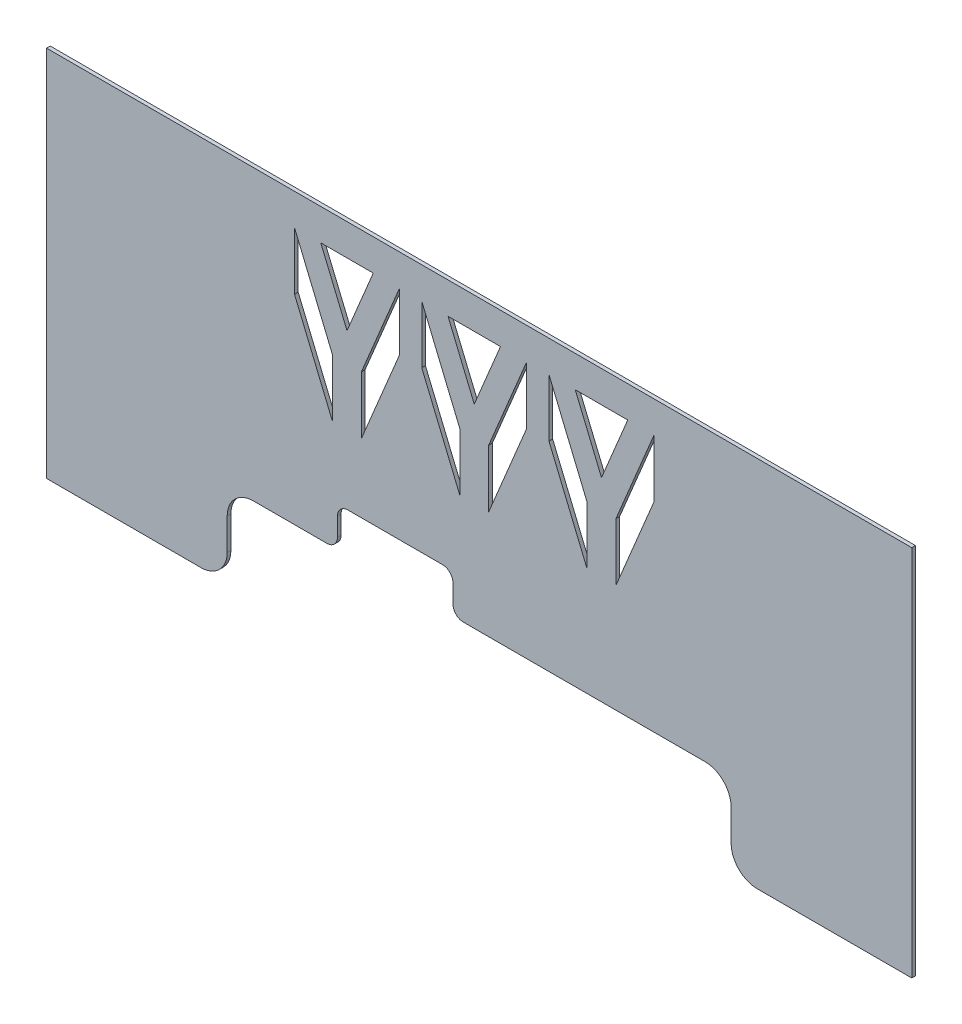
from build123d import *

# Parameters (mm, degrees)
BOSS_EXTRUDE1_DEPTH = 0.7
BOSS_EXTRUDE2_DEPTH = 5
FILLET1_R           = 5
FILLET2_R           = 2


with BuildPart() as part:
    # Sketch1 → Boss-Extrude1 (new body)
    with BuildSketch(Plane.XY):
        Polygon((0, 71), (0, 0), (34.4076055, 0), (34.4076055, 16), (55.4076055, 16), (55.4076055, 23.5), (77.4076055, 23.5), (77.4076055, 16), (130.4076055, 16), (130.4076055, 0), (164.815211, 0), (164.815211, 71), align=None)
        Polygon((47.233378, 65), (54.483378, 47.6), (54.483378, 36.6), (47.233378, 54), align=None, mode=Mode.SUBTRACT)
        Polygon((67.233378, 65), (67.233378, 54), (59.983378, 36.6), (59.983378, 47.6), align=None, mode=Mode.SUBTRACT)
        Polygon((71.472387, 65), (78.722387, 47.6), (78.722387, 36.6), (71.472387, 54), align=None, mode=Mode.SUBTRACT)
        Polygon((57.233378, 53), (52.233378, 65), (62.233378, 65), align=None, mode=Mode.SUBTRACT)
        Polygon((81.472387, 53), (76.472387, 65), (86.472387, 65), align=None, mode=Mode.SUBTRACT)
        Polygon((91.472387, 65), (91.472387, 54), (84.222387, 36.6), (84.222387, 47.6), align=None, mode=Mode.SUBTRACT)
        Polygon((95.711396, 65), (102.961396, 47.6), (102.961396, 36.6), (95.711396, 54), align=None, mode=Mode.SUBTRACT)
        Polygon((115.711396, 65), (115.711396, 54), (108.461396, 36.6), (108.461396, 47.6), align=None, mode=Mode.SUBTRACT)
        Polygon((105.711396, 53), (100.711396, 65), (110.711396, 65), align=None, mode=Mode.SUBTRACT)
    extrude(amount=BOSS_EXTRUDE1_DEPTH)

    # Sketch1<4> → Boss-Extrude2 (add)
    with BuildSketch(Plane.XY):
        Polygon((10.891348, 64.75), (15.516348, 53.65), (20.141348, 64.75), align=None)
        Polygon((5.766348, 63.75), (5.766348, 54.05), (12.516348, 37.85), (12.516348, 47.55), align=None)
        Polygon((25.266348, 63.75), (18.516348, 47.55), (18.516348, 37.85), (25.266348, 54.05), align=None)
        Polygon((144.673863, 64.75), (149.298863, 53.65), (153.923863, 64.75), align=None)
        Polygon((139.548863, 54.05), (146.298863, 37.85), (146.298863, 47.55), (139.548863, 63.75), align=None)
        Polygon((159.048863, 54.05), (159.048863, 63.75), (152.298863, 47.55), (152.298863, 37.85), align=None)
    extrude(amount=-BOSS_EXTRUDE2_DEPTH)

    # Fillet1
    fillet1_edges = [part.edges().sort_by_distance(p)[0] for p in [
        (130.4076055, 16, 0.35),
        (130.4076055, 0, 0.35),
        (34.4076055, 0, 0.35),
        (34.4076055, 16, 0.35),
    ]]
    fillet(fillet1_edges, radius=FILLET1_R)

    # Fillet2
    fillet2_edges = [part.edges().sort_by_distance(p)[0] for p in [
        (77.4076055, 16, 0.35),
        (77.4076055, 23.5, 0.35),
        (55.4076055, 16, 0.35),
        (55.4076055, 23.5, 0.35),
    ]]
    fillet(fillet2_edges, radius=FILLET2_R)


solid = part.part
